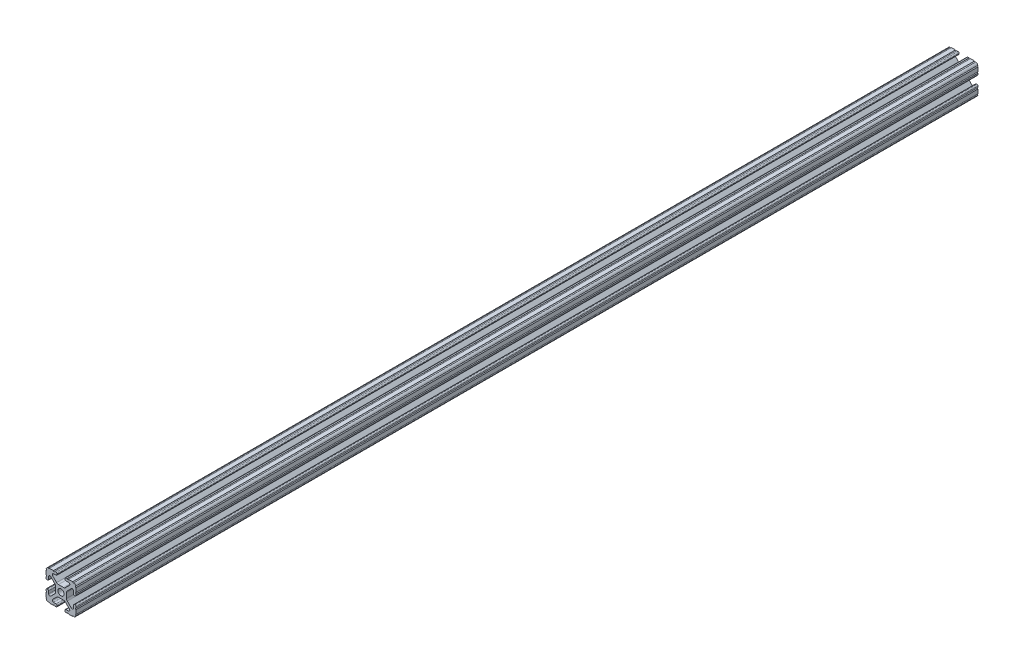
from build123d import *

# Parameters (mm, degrees)
BOSS_EXTRUDE1_DEPTH     = 381
CUT_EXTRUDE1_DEPTH      = 382.423098409
CUT_EXTRUDE1_DEPTH_BACK = 382.423098409
SKETCH5_R               = 0.55245


with BuildPart() as part:
    # Sketch4 → Boss-Extrude1 (new, symmetric)
    with BuildSketch(Plane.XY):
        with BuildLine():
            Line((4.190365, -12.7), (10.11729625, -12.7))
            ThreePointArc((10.11729625, -12.7), (11.943543585, -11.943543585), (12.7, -10.11729625))
            Line((12.7, -10.11729625), (12.7, -4.190365))
            ThreePointArc((12.7, -4.190365), (12.42492494, -3.52627506), (11.760835, -3.2512))
            Line((11.760835, -3.2512), (11.429365, -3.2512))
            ThreePointArc((11.429365, -3.2512), (10.76527506, -3.52627506), (10.4902, -4.190365))
            Line((10.4902, -4.190365), (10.4902, -6.348478019))
            ThreePointArc((10.4902, -6.348478019), (9.830707141, -7.335478831), (8.666460301, -7.103895736))
            Line((8.666460301, -7.103895736), (5.299899128, -3.737334563))
            ThreePointArc((5.299899128, -3.737334563), (4.817571085, -3.015479634), (4.6482, -2.16399369))
            Line((4.6482, -2.16399369), (4.6482, 0))
            Line((4.6482, 0), (2.6035, 0))
            ThreePointArc((2.6035, 0), (1.840952505, -1.840952505), (0, -2.6035))
            Line((0, -2.6035), (0, -4.6482))
            Line((0, -4.6482), (2.16399369, -4.6482))
            ThreePointArc((2.16399369, -4.6482), (3.015479634, -4.817571085), (3.737334563, -5.299899128))
            Line((3.737334563, -5.299899128), (7.103895736, -8.666460301))
            ThreePointArc((7.103895736, -8.666460301), (7.335478831, -9.830707141), (6.348478019, -10.4902))
            Line((6.348478019, -10.4902), (4.190365, -10.4902))
            ThreePointArc((4.190365, -10.4902), (3.52627506, -10.76527506), (3.2512, -11.429365))
            Line((3.2512, -11.429365), (3.2512, -11.760835))
            ThreePointArc((3.2512, -11.760835), (3.52627506, -12.42492494), (4.190365, -12.7))
        make_face()
    extrude(amount=BOSS_EXTRUDE1_DEPTH, both=True)

    # Sketch5 → Cut-Extrude1 (cut, two sides: drawn at the far end of the back side and taken through both)
    with BuildSketch(Plane.XY.offset(-CUT_EXTRUDE1_DEPTH_BACK)):
        with Locations((10.356153152, -12.7)):
            Circle(SKETCH5_R)
        with Locations((5.796028019, -12.7)):
            Circle(SKETCH5_R)
        with Locations((12.7, -10.356153152)):
            Circle(SKETCH5_R)
        with Locations((12.7, -5.796028019)):
            Circle(SKETCH5_R)
    extrude(amount=CUT_EXTRUDE1_DEPTH + CUT_EXTRUDE1_DEPTH_BACK, mode=Mode.SUBTRACT)

    # Mirror1: part across plane


with BuildPart() as part_1:
    add(part.part)
    add(part.part.mirror(Plane(origin=(0, 0, 0), x_dir=(0, 0, 1), z_dir=(1, 0, 0))))

    # Mirror2: part across plane


with BuildPart() as part_2:
    add(part_1.part)
    add(part_1.part.mirror(Plane.ZX))


solid = part_2.part
